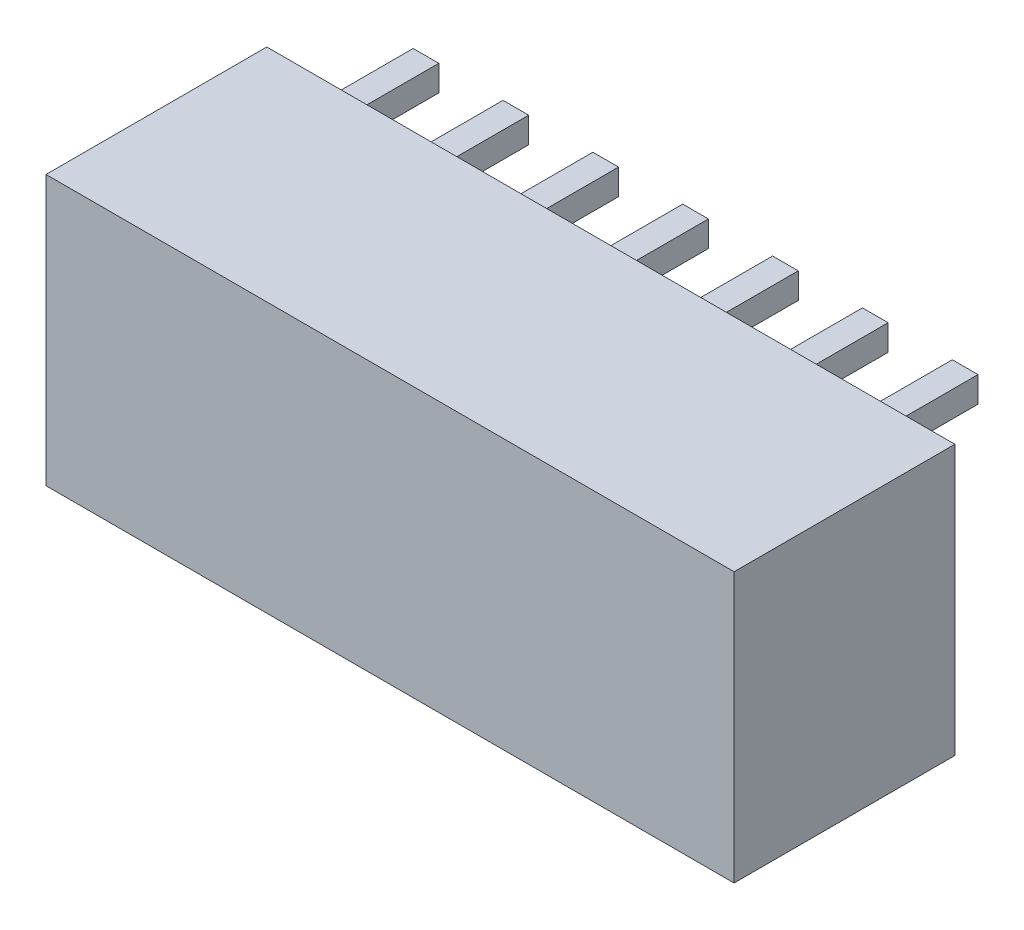
from build123d import *

# Parameters (mm, degrees)
SKETCH_1_W                         = 26.8
SKETCH_1_H                         = 10.5
EXTRUDE_1_DEPTH                    = 8.6
CUT_EXTRUDE_1_DEPTH                = 7
EXTRUDE_START                      = -5
SKETCH_3_W                         = 1
SKETCH_3_H                         = 1
EXTRUDE_2_DEPTH                    = 8.6
CHAMFER_1_SIZE                     = 0.3
SKETCH_4_W                         = 1
SKETCH_4_H                         = 1
EXTRUDE_3_DEPTH                    = 5
PATTERN_LINEAR_1_COUNT             = 7
PATTERN_LINEAR_1_PITCH             = 3.5
CHAMFER_1_OF_PATTERN_LINEAR_1_SIZE = 0.3


with BuildPart() as part:
    # Эскиз1 → Бобышка-Вытянуть1 (new body)
    with BuildSketch(Plane.XY):
        with Locations((0, 5.25)):
            Rectangle(SKETCH_1_W, SKETCH_1_H)
    extrude(amount=EXTRUDE_1_DEPTH)

    # Эскиз2 → Вырез-Вытянуть1 (cut)
    with BuildSketch(Plane.XZ):
        Polygon((-12.4, 6.6), (12.4, 6.6), (12.4, 0.2), (10.2, 0.2), (10.2, 1.8), (-8.6, 1.8), (-8.6, 0.2), (-10.8, 0.2), (-10.8, 1.8), (-12.4, 1.8), align=None)
    extrude(amount=-CUT_EXTRUDE_1_DEPTH, mode=Mode.SUBTRACT)

    # Эскиз3 → Бобышка-Вытянуть2 (add)
    with BuildSketch(Plane(origin=(0, 0, 0), x_dir=(-1, 0, 0), z_dir=(0, 0, -1)).offset(EXTRUDE_START)):
        with Locations((10.5, 9.5)):
            Rectangle(SKETCH_3_W, SKETCH_3_H)
    extrude_2 = extrude(amount=EXTRUDE_2_DEPTH)

    # Фаска1
    chamfer_1_edges = [part.edges().sort_by_distance(p)[0] for p in [
        (-10, 9.5, -3.6),
        (-10.5, 9, -3.6),
        (-11, 9.5, -3.6),
        (-10.5, 10, -3.6),
    ]]
    chamfer(chamfer_1_edges, length=CHAMFER_1_SIZE)

    # Эскиз4 → Бобышка-Вытянуть3 (add)
    with BuildSketch(Plane.XZ.offset(-7)):
        with Locations((-10.5, 4.35)):
            Rectangle(SKETCH_4_W, SKETCH_4_H)
    extrude_3 = extrude(amount=EXTRUDE_3_DEPTH)

    # Линейный массив1: Бобышка-Вытянуть2, Бобышка-Вытянуть3 ×7
    with Locations(*[(i * PATTERN_LINEAR_1_PITCH, 0, 0) for i in range(1, PATTERN_LINEAR_1_COUNT)]):
        add(extrude_2)
        add(extrude_3)

    # Фаска1 of Линейный массив1
    chamfer_1_of_pattern_linear_1_edges = [part.edges().sort_by_distance(p)[0] for p in [
        (-6.5, 9.5, -3.6),
        (-7, 9, -3.6),
        (-7.5, 9.5, -3.6),
        (-7, 10, -3.6),
        (-3, 9.5, -3.6),
        (-3.5, 9, -3.6),
        (-4, 9.5, -3.6),
        (-3.5, 10, -3.6),
        (0.5, 9.5, -3.6),
        (0, 9, -3.6),
        (-0.5, 9.5, -3.6),
        (0, 10, -3.6),
        (4, 9.5, -3.6),
        (3.5, 9, -3.6),
        (3, 9.5, -3.6),
        (3.5, 10, -3.6),
        (7.5, 9.5, -3.6),
        (7, 9, -3.6),
        (6.5, 9.5, -3.6),
        (7, 10, -3.6),
        (11, 9.5, -3.6),
        (10.5, 9, -3.6),
        (10, 9.5, -3.6),
        (10.5, 10, -3.6),
    ]]
    chamfer(chamfer_1_of_pattern_linear_1_edges, length=CHAMFER_1_OF_PATTERN_LINEAR_1_SIZE)


solid = part.part
